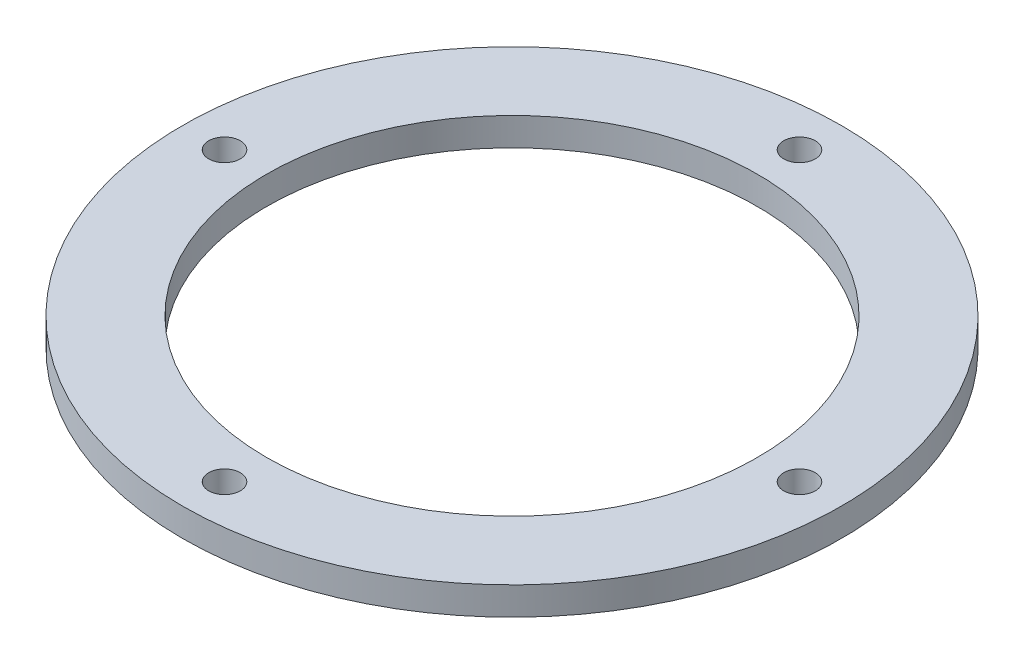
from build123d import *

# Parameters (mm, degrees)
SCHIZZO1_R                   = 47
SCHIZZO1_R_2                 = 35
ESTRUSIONE_ESTRUSIONE1_DEPTH = 4
SCHIZZO2_R                   = 2.25
TAGLIO_ESTRUSIONE1_DEPTH     = 4


with BuildPart() as part:
    # Schizzo1 → Estrusione-Estrusione1 (new body)
    with BuildSketch(Plane(origin=(0, 0, 0), x_dir=(1, 0, 0), z_dir=(0, 1, 0))):
        with Locations(Location((0, 0, 0), (0, 0, 270))):
            Circle(SCHIZZO1_R)
        with Locations(Location((0, 0, 0), (0, 0, 270))):
            Circle(SCHIZZO1_R_2, mode=Mode.SUBTRACT)
    extrude(amount=ESTRUSIONE_ESTRUSIONE1_DEPTH)

    # Schizzo2 → Taglio-Estrusione1 (cut)
    with BuildSketch(Plane(origin=(0, 4, 0), x_dir=(1, 0, 0), z_dir=(0, 1, 0))):
        with Locations(Location((0, 41, 0), (0, 0, 270))):
            Circle(SCHIZZO2_R)
        with Locations(Location((41, 0, 0), (0, 0, 270))):
            Circle(SCHIZZO2_R)
        with Locations(Location((0, -41, 0), (0, 0, 270))):
            Circle(SCHIZZO2_R)
        with Locations(Location((-41, 0, 0), (0, 0, 270))):
            Circle(SCHIZZO2_R)
    extrude(amount=-TAGLIO_ESTRUSIONE1_DEPTH, mode=Mode.SUBTRACT)


solid = part.part
